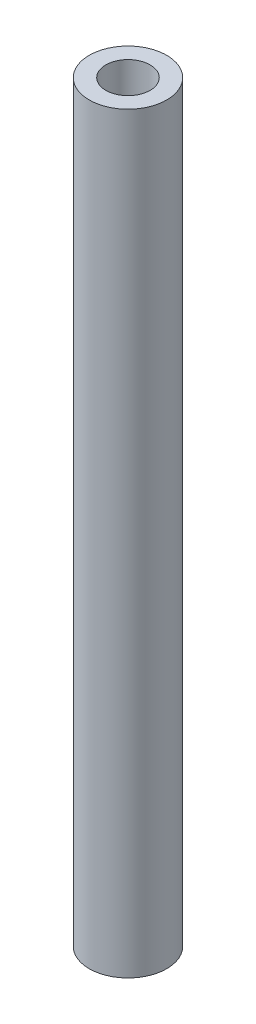
from build123d import *

# Parameters (mm, degrees)
SKETCH_1_R      = 7
SKETCH_1_R_2    = 4
EXTRUDE_1_DEPTH = 136


with BuildPart() as part:
    # 草图1 → 凸台-拉伸1 (new body)
    with BuildSketch(Plane(origin=(0, 0, 0), x_dir=(1, 0, 0), z_dir=(0, 1, 0))):
        with Locations(Location((0, 0, 0), (0, 0, 270))):
            Circle(SKETCH_1_R)
        with Locations(Location((0, 0, 0), (0, 0, 270))):
            Circle(SKETCH_1_R_2, mode=Mode.SUBTRACT)
    extrude(amount=EXTRUDE_1_DEPTH)


solid = part.part
